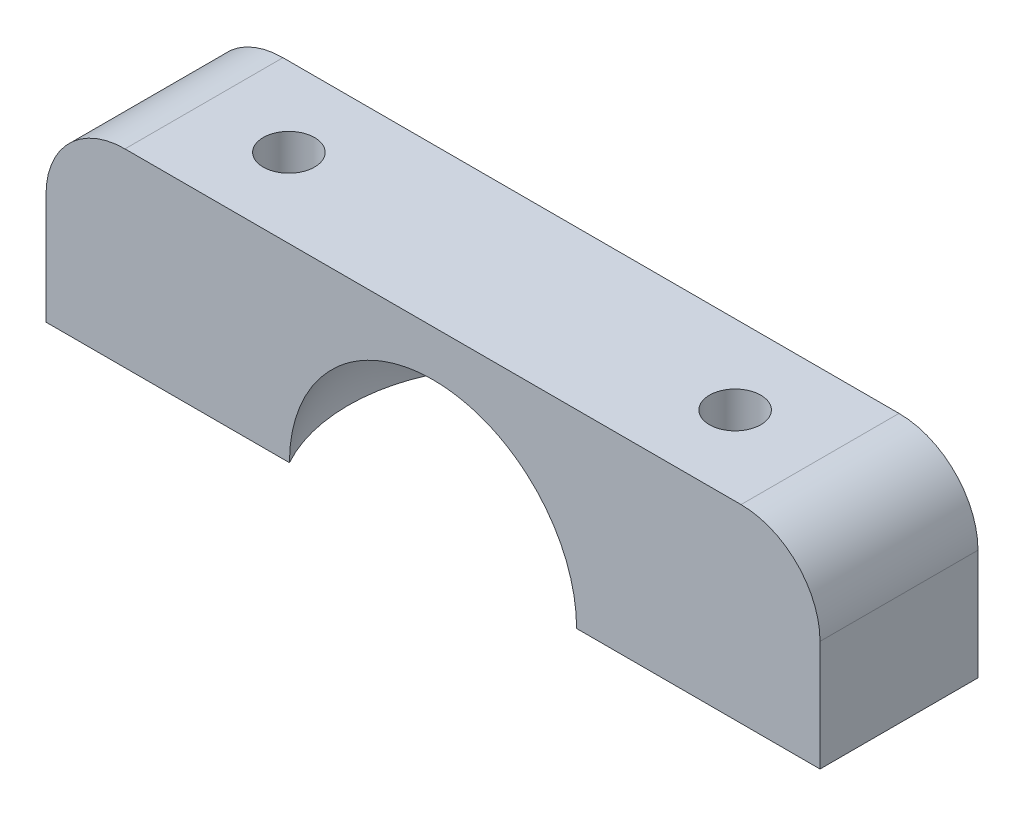
from build123d import *

# Parameters (mm, degrees)
EXTRUDE_1_DEPTH = 2
HOLE_WIZARD_1_D = 1.3
FILLET_1_R      = 2


with BuildPart() as part:
    # 草图1 → 凸台-拉伸1 (new, symmetric)
    with BuildSketch(Plane.XY):
        Polygon((-3.464101615, 0), (-9.8, 0), (-9.8, -4.8), (9.8, -4.8), (9.8, 0), (3.464101615, 0), align=None)
    extrude(amount=EXTRUDE_1_DEPTH, both=True)

    # 孔1 (through all)
    with Locations(Plane(origin=(0, 0, 0), x_dir=(1, 0, 0), z_dir=(0, 1, 0))):
        with Locations((-5.65, 0), (5.65, 0)):
            Hole(HOLE_WIZARD_1_D / 2)

    # 草图5 → 切除-旋转1 (revolve, cut)
    with BuildSketch(Plane.XY):
        with BuildLine():
            Line((0, -8.95), (0, -4.8))
            Line((0, -4.8), (0, -0.65))
            ThreePointArc((0, -0.65), (-4.15, -4.8), (0, -8.95))
        make_face()
    revolve(axis=Axis((0, 0, 0), (0, -1, 0)), mode=Mode.SUBTRACT)

    # 圆角1
    fillet_1_edges = [part.edges().sort_by_distance(p)[0] for p in [
        (9.8, 0, 0),
        (-9.8, 0, 0),
    ]]
    fillet(fillet_1_edges, radius=FILLET_1_R)


solid = part.part
